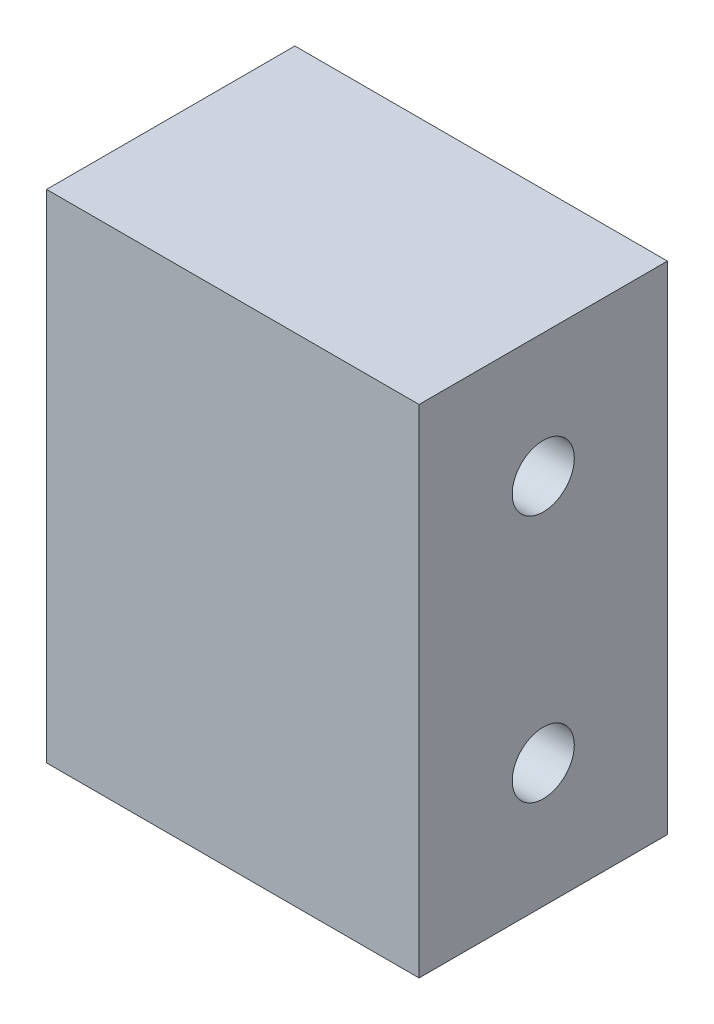
from build123d import *

# Parameters (mm, degrees)
SKETCH_1_W      = 40
SKETCH_1_H      = 80
SKETCH_1_R      = 5
EXTRUDE_1_DEPTH = 60


with BuildPart() as part:
    # Эскиз1 → Бобышка-Вытянуть1 (new body)
    with BuildSketch(Plane(origin=(0, 0, 0), x_dir=(0, 0, -1), z_dir=(1, 0, 0))):
        with Locations((20, 40)):
            Rectangle(SKETCH_1_W, SKETCH_1_H)
        with Locations((20, 60)):
            Circle(SKETCH_1_R, mode=Mode.SUBTRACT)
        with Locations((20, 20)):
            Circle(SKETCH_1_R, mode=Mode.SUBTRACT)
    extrude(amount=EXTRUDE_1_DEPTH)


solid = part.part
